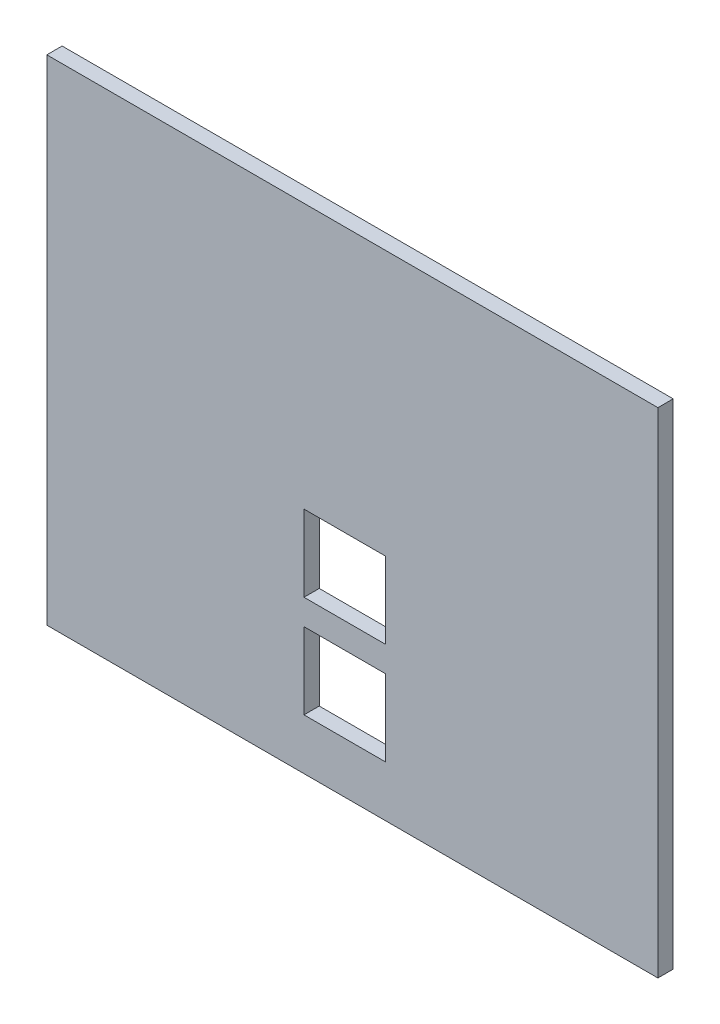
from build123d import *

# Parameters (mm, degrees)
ESBO_O1_W                = 120
ESBO_O1_H                = 97
RESSALTO_EXTRUS_O1_DEPTH = 3
ESBO_O2_W                = 16
ESBO_O2_H                = 15
CORTE_EXTRUS_O1_DEPTH    = 78.209131584
PADR_O_LINEAR1_COUNT     = 2
PADR_O_LINEAR1_PITCH     = 20


with BuildPart() as part:
    # Esboço1 → Ressalto-extrusão1 (new body)
    with BuildSketch(Plane.XY):
        Rectangle(ESBO_O1_W, ESBO_O1_H)
    extrude(amount=RESSALTO_EXTRUS_O1_DEPTH)

    # Esboço2 → Corte-extrusão1 (cut, through all)
    with BuildSketch(Plane.XY.offset(3)):
        with Locations((-1.5, -31)):
            Rectangle(ESBO_O2_W, ESBO_O2_H)
    corte_extrus_o1 = extrude(amount=-CORTE_EXTRUS_O1_DEPTH, mode=Mode.SUBTRACT)

    # Padrão linear1: Corte-extrusão1 ×2
    with Locations(*[(0, i * PADR_O_LINEAR1_PITCH, 0) for i in range(1, PADR_O_LINEAR1_COUNT)]):
        add(corte_extrus_o1, mode=Mode.SUBTRACT)


solid = part.part
